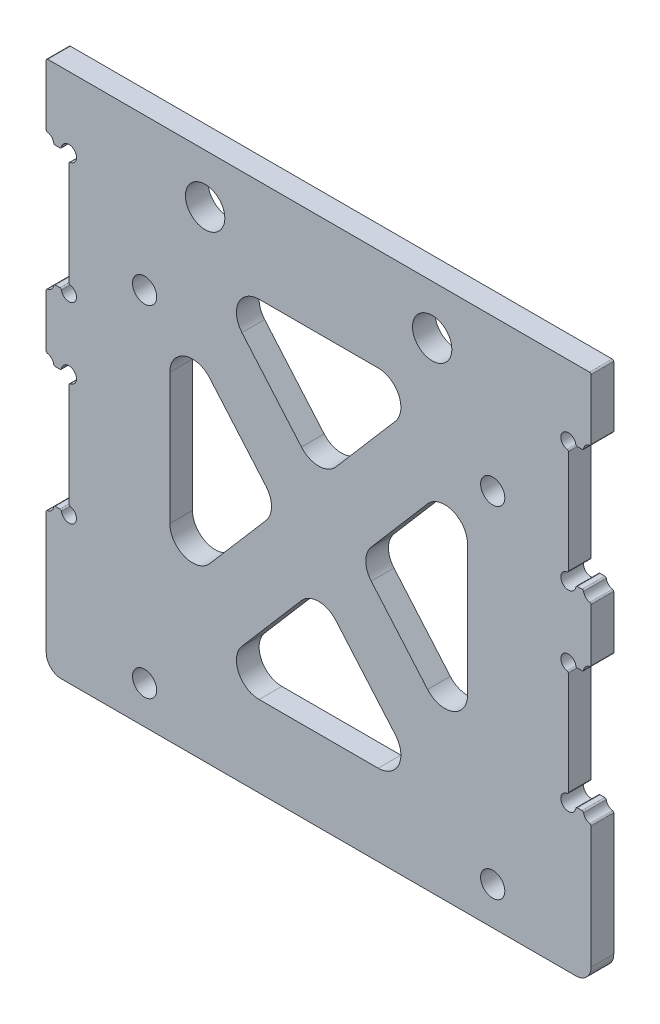
from build123d import *
from OCP.BRepFilletAPI import BRepFilletAPI_MakeFillet

# Parameters (mm, degrees)
SKETCH_1_R          = 2.6
EXTRUDE_1_DEPTH     = 3
FILLET_1_R1         = 0.2
FILLET_1_R2         = 2
SKETCH_2_R          = 1.6
CUT_EXTRUDE_1_DEPTH = 10
SKETCH_8_R          = 1.6
CUT_EXTRUDE_5_DEPTH = 3
SKETCH_10_R         = 1.6
CUT_EXTRUDE_6_DEPTH = 10
SKETCH_11_W         = 39.340466826
SKETCH_11_H         = 45.8017909
CUT_EXTRUDE_7_DEPTH = 10
EXTRUDE_1_2_DEPTH   = 3
FILLET_2_R          = 3


with BuildPart() as part:
    # 草图1 → Extrude 1 (new body)
    with BuildSketch(Plane.XY):
        with BuildLine():
            Line((36, 0), (-36, 0))
            Line((-36, 0), (-36, -8.333333333))
            ThreePointArc((-36, -8.333333333), (-35.292893219, -8.626226552), (-35, -9.333333333))
            Line((-35, -9.333333333), (-34, -9.333333333))
            ThreePointArc((-34, -9.333333333), (-32.292893219, -8.626226552), (-33, -10.333333333))
            Line((-33, -10.333333333), (-33, -24.333333333))
            ThreePointArc((-33, -24.333333333), (-32.292893219, -26.040440115), (-34, -25.333333333))
            Line((-34, -25.333333333), (-35, -25.333333333))
            ThreePointArc((-35, -25.333333333), (-35.292893219, -26.040440115), (-36, -26.333333333))
            Line((-36, -26.333333333), (-36, -33.666666667))
            ThreePointArc((-36, -33.666666667), (-35.292893219, -33.959559885), (-35, -34.666666667))
            Line((-35, -34.666666667), (-34, -34.666666667))
            ThreePointArc((-34, -34.666666667), (-32.292893219, -33.959559885), (-33, -35.666666667))
            Line((-33, -35.666666667), (-33, -49.666666667))
            ThreePointArc((-33, -49.666666667), (-32.292893219, -51.373773448), (-34, -50.666666667))
            Line((-34, -50.666666667), (-35, -50.666666667))
            ThreePointArc((-35, -50.666666667), (-35.292893219, -51.373773448), (-36, -51.666666667))
            Line((-36, -51.666666667), (-36, -70))
            Line((-36, -70), (36, -70))
            Line((36, -70), (36, -51.666666667))
            ThreePointArc((36, -51.666666667), (35.292893219, -51.373773448), (35, -50.666666667))
            Line((35, -50.666666667), (34, -50.666666667))
            ThreePointArc((34, -50.666666667), (32.292893219, -51.373773448), (33, -49.666666667))
            Line((33, -49.666666667), (33, -35.666666667))
            ThreePointArc((33, -35.666666667), (32.292893219, -33.959559885), (34, -34.666666667))
            Line((34, -34.666666667), (35, -34.666666667))
            ThreePointArc((35, -34.666666667), (35.292893219, -33.959559885), (36, -33.666666667))
            Line((36, -33.666666667), (36, -26.333333333))
            ThreePointArc((36, -26.333333333), (35.292893219, -26.040440115), (35, -25.333333333))
            Line((35, -25.333333333), (34, -25.333333333))
            ThreePointArc((34, -25.333333333), (32.292893219, -26.040440115), (33, -24.333333333))
            Line((33, -24.333333333), (33, -10.333333333))
            ThreePointArc((33, -10.333333333), (32.292893219, -8.626226552), (34, -9.333333333))
            Line((34, -9.333333333), (35, -9.333333333))
            ThreePointArc((35, -9.333333333), (35.292893219, -8.626226552), (36, -8.333333333))
            Line((36, -8.333333333), (36, 0))
        make_face()
        with Locations((-15, -6.5)):
            Circle(SKETCH_1_R, mode=Mode.SUBTRACT)
        with Locations((15, -6.5)):
            Circle(SKETCH_1_R, mode=Mode.SUBTRACT)
    extrude(amount=EXTRUDE_1_DEPTH)

    # 圆角1: one fillet with a radius per group of edges: ONE call of the kernel's fillet builder (fillet() takes one radius for all edges)
    fillet_1_edges_1 = [part.edges().sort_by_distance(p)[0] for p in [
        (-35, -9.333333333, 1.5),
        (-34, -9.333333333, 1.5),
        (33, -10.333333333, 1.5),
        (34, -9.333333333, 1.5),
        (35, -9.333333333, 1.5),
        (36, -8.333333333, 1.5),
        (36, 0, 1.5),
        (-36, 0, 1.5),
        (-36, -8.333333333, 1.5),
        (-33, -10.333333333, 1.5),
        (-33, -24.333333333, 1.5),
        (-34, -25.333333333, 1.5),
        (-35, -25.333333333, 1.5),
        (-36, -26.333333333, 1.5),
        (-36, -33.666666667, 1.5),
        (-35, -34.666666667, 1.5),
        (-34, -34.666666667, 1.5),
        (-33, -35.666666667, 1.5),
        (-33, -49.666666667, 1.5),
        (-34, -50.666666667, 1.5),
        (-35, -50.666666667, 1.5),
        (-36, -51.666666667, 1.5),
        (36, -51.666666667, 1.5),
        (35, -50.666666667, 1.5),
        (34, -50.666666667, 1.5),
        (33, -49.666666667, 1.5),
        (33, -35.666666667, 1.5),
        (34, -34.666666667, 1.5),
        (35, -34.666666667, 1.5),
        (36, -33.666666667, 1.5),
        (36, -26.333333333, 1.5),
        (35, -25.333333333, 1.5),
        (34, -25.333333333, 1.5),
        (33, -24.333333333, 1.5),
    ]]
    fillet_1_edges_2 = [part.edges().sort_by_distance(p)[0] for p in [
        (-36, -70, 1.5),
        (36, -70, 1.5),
    ]]
    fillet_1 = BRepFilletAPI_MakeFillet(part.part.solid().wrapped)
    for e in fillet_1_edges_1:
        fillet_1.Add(FILLET_1_R1, e.wrapped)
    for e in fillet_1_edges_2:
        fillet_1.Add(FILLET_1_R2, e.wrapped)
    add(Compound.cast(fillet_1.Shape()), mode=Mode.REPLACE)

    # 草图2 → 切除-拉伸1 (cut)
    with BuildSketch(Plane.XY.offset(3)):
        with Locations((-23, -20)):
            Circle(SKETCH_2_R)
        with Locations((23, -20)):
            Circle(SKETCH_2_R)
    extrude(amount=-CUT_EXTRUDE_1_DEPTH, mode=Mode.SUBTRACT)

    # 草图8 → 切除-拉伸5 (cut)
    with BuildSketch(Plane.XY.offset(3)):
        with Locations((23, -65)):
            Circle(SKETCH_8_R)
        with Locations((-23, -65)):
            Circle(SKETCH_8_R)
    extrude(amount=-CUT_EXTRUDE_5_DEPTH, mode=Mode.SUBTRACT)

    # 草图10 → 切除-拉伸6 (cut)
    with BuildSketch(Plane.XY.offset(3)):
        with Locations((-12, -30)):
            Circle(SKETCH_10_R)
        with Locations((-12, -40)):
            Circle(SKETCH_10_R)
        with Locations((12, -40)):
            Circle(SKETCH_10_R)
        with Locations((12, -30)):
            Circle(SKETCH_10_R)
    extrude(amount=-CUT_EXTRUDE_6_DEPTH, mode=Mode.SUBTRACT)

    # 草图11 → 切除-拉伸7 (cut)
    with BuildSketch(Plane.XY.offset(3)):
        with Locations((0, -36.393264277)):
            Rectangle(SKETCH_11_W, SKETCH_11_H)
    extrude(amount=-CUT_EXTRUDE_7_DEPTH, mode=Mode.SUBTRACT)

    # 草图12 → Extrude 1 2 (add)
    with BuildSketch(Plane.XY.offset(3)):
        Polygon((17.282301657, -10.133497371), (-23.728051839, -57.879439072), (-17.659356964, -63.092014492), (23.350996533, -15.346072791), align=None)
        Polygon((-23.419012344, -15.266885984), (17.312700126, -62.688422331), (23.381395001, -57.475846911), (-17.350317469, -10.054310564), align=None)
    extrude(amount=-EXTRUDE_1_2_DEPTH)

    # 圆角2
    fillet_2_edges = [part.edges().sort_by_distance(p)[0] for p in [
        (0, -42.532264181, 1.5),
        (14.397270996, -59.294159727, 1.5),
        (-14.397270996, -59.294159727, 1.5),
        (-19.670233413, -19.631368731, 1.5),
        (-5.272962417, -36.393264277, 1.5),
        (-19.670233413, -53.155159823, 1.5),
        (19.670233413, -53.155159823, 1.5),
        (5.272962417, -36.393264277, 1.5),
        (19.670233413, -19.631368731, 1.5),
        (-14.397270996, -13.492368827, 1.5),
        (14.397270996, -13.492368827, 1.5),
        (0, -30.254264374, 1.5),
    ]]
    fillet(fillet_2_edges, radius=FILLET_2_R)


solid = part.part
